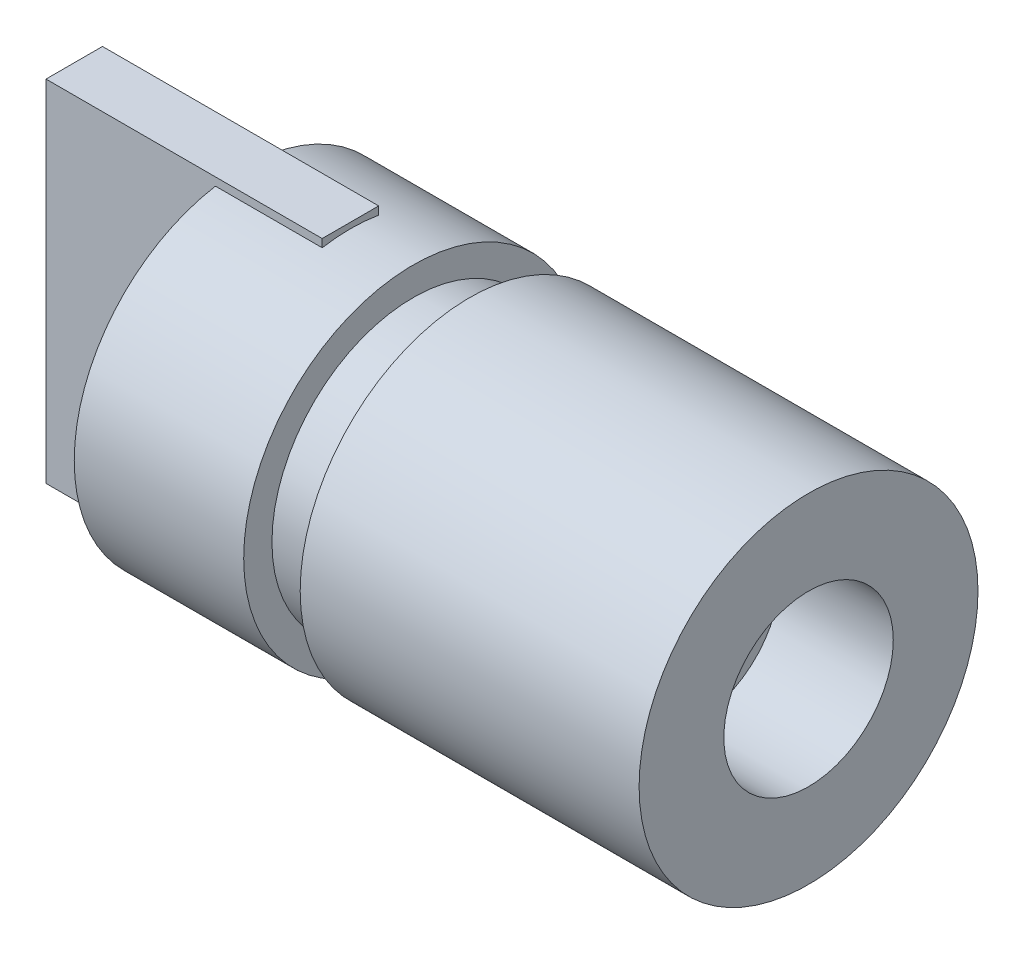
from build123d import *

# Parameters (mm, degrees)
SKETCH_1_R          = 3
EXTRUDE_1_DEPTH     = 10
SKETCH_2_W          = 1
SKETCH_2_H          = 0.5
SKETCH_3_R          = 1.5
CUT_EXTRUDE_1_DEPTH = 2
SKETCH_4_W          = 4.889658543
SKETCH_4_H          = 6.2
EXTRUDE_2_DEPTH     = 0.5


with BuildPart() as part:
    # Эскиз1 → Бобышка-Вытянуть1 (new body)
    with BuildSketch(Plane(origin=(0, 0, 0), x_dir=(0, 0, -1), z_dir=(1, 0, 0))):
        Circle(SKETCH_1_R)
    extrude(amount=EXTRUDE_1_DEPTH)

    # Эскиз2 → Вырез-Повернуть1 (revolve, cut)
    with BuildSketch(Plane.XY, mode=Mode.PRIVATE) as cut_revolve_1_sk:
        with Locations((3.5, 2.75)):
            Rectangle(SKETCH_2_W, SKETCH_2_H)
    revolve(cut_revolve_1_sk.sketch.rotate(Axis((-1000, 0, 0), (1, 0, 0)), 90), axis=Axis((-1000, 0, 0), (1, 0, 0)), mode=Mode.SUBTRACT)

    # Эскиз3 → Вырез-Вытянуть1 (cut)
    with BuildSketch(Plane(origin=(10, 0, 0), x_dir=(0, 0, -1), z_dir=(1, 0, 0))):
        Circle(SKETCH_3_R)
    extrude(amount=-CUT_EXTRUDE_1_DEPTH, mode=Mode.SUBTRACT)

    # Эскиз4 → Бобышка-Вытянуть2 (add, symmetric)
    with BuildSketch(Plane.XY):
        with Locations((-0.555170728, 0)):
            Rectangle(SKETCH_4_W, SKETCH_4_H)
    extrude(amount=EXTRUDE_2_DEPTH, both=True)


solid = part.part
